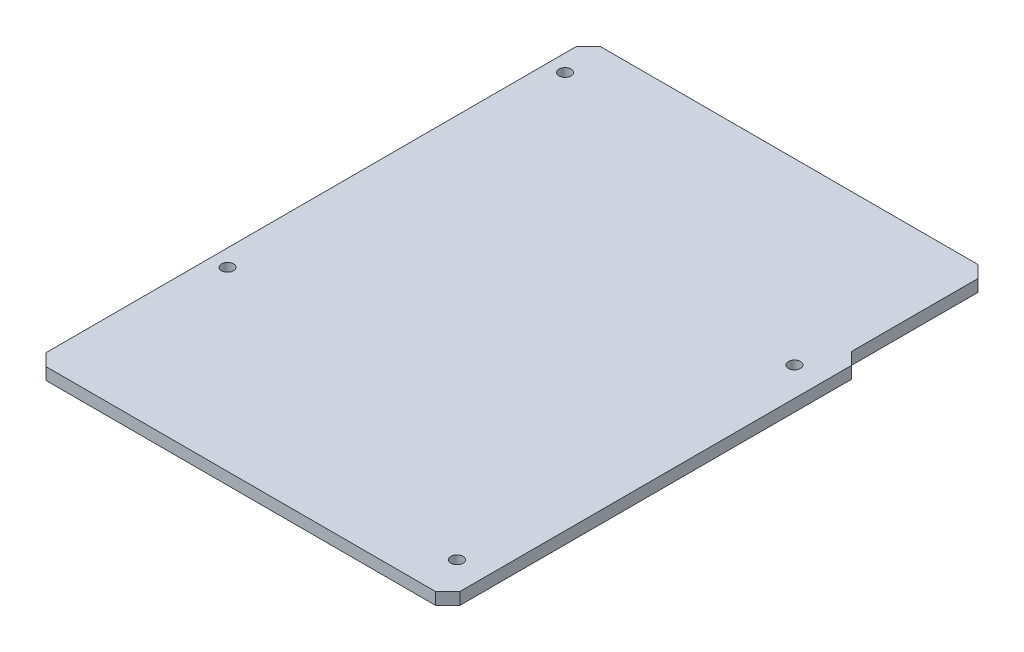
from build123d import *

# Parameters (mm, degrees)
SKETCH1_W           = 100
SKETCH1_H           = 145
SKETCH1_R           = 1.5
BOSS_EXTRUDE1_DEPTH = 3
SKETCH2_W           = 100
SKETCH2_H           = 7
CUT_EXTRUDE1_DEPTH  = 89.120655921
BOSS_EXTRUDE2_DEPTH = 3
CHAMFER1_SIZE       = 3
CHAMFER2_SIZE       = 3


with BuildPart() as part:
    # Sketch1 → Boss-Extrude1 (new body)
    with BuildSketch(Plane(origin=(0, 0, 0), x_dir=(1, 0, 0), z_dir=(0, 1, 0))):
        Rectangle(SKETCH1_W, SKETCH1_H)
        with Locations(Location((-45.8, 55.5, 0), (0, 0, 270))):
            Circle(SKETCH1_R, mode=Mode.SUBTRACT)
        with Locations(Location((-45.8, -28.5, 0), (0, 0, 270))):
            Circle(SKETCH1_R, mode=Mode.SUBTRACT)
        with Locations(Location((45.8, -63, 0), (0, 0, 90))):
            Circle(SKETCH1_R, mode=Mode.SUBTRACT)
        with Locations(Location((45.8, 21, 0), (0, 0, 90))):
            Circle(SKETCH1_R, mode=Mode.SUBTRACT)
    extrude(amount=BOSS_EXTRUDE1_DEPTH)

    # Sketch2 → Cut-Extrude1 (cut, through all)
    with BuildSketch(Plane(origin=(0, 3, 0), x_dir=(1, 0, 0), z_dir=(0, 1, 0))):
        with Locations((0, 69)):
            Rectangle(SKETCH2_W, SKETCH2_H)
    extrude(amount=-CUT_EXTRUDE1_DEPTH, mode=Mode.SUBTRACT)

    # Sketch3 → Boss-Extrude2 (add)
    with BuildSketch(Plane.XZ):
        Polygon((50, 72.5), (53, 69.5), (53, -28), (50, -31), align=None)
    extrude(amount=-BOSS_EXTRUDE2_DEPTH)

    # Chamfer1
    chamfer1_edges = [part.edges().sort_by_distance(p)[0] for p in [
        (-50, 1.5, -65.5),
        (50, 1.5, -65.5),
    ]]
    chamfer(chamfer1_edges, length=CHAMFER1_SIZE)

    # Chamfer2
    chamfer2_edges = [part.edges().sort_by_distance(p)[0] for p in [
        (-50, 1.5, 72.5),
    ]]
    chamfer(chamfer2_edges, length=CHAMFER2_SIZE)


solid = part.part
